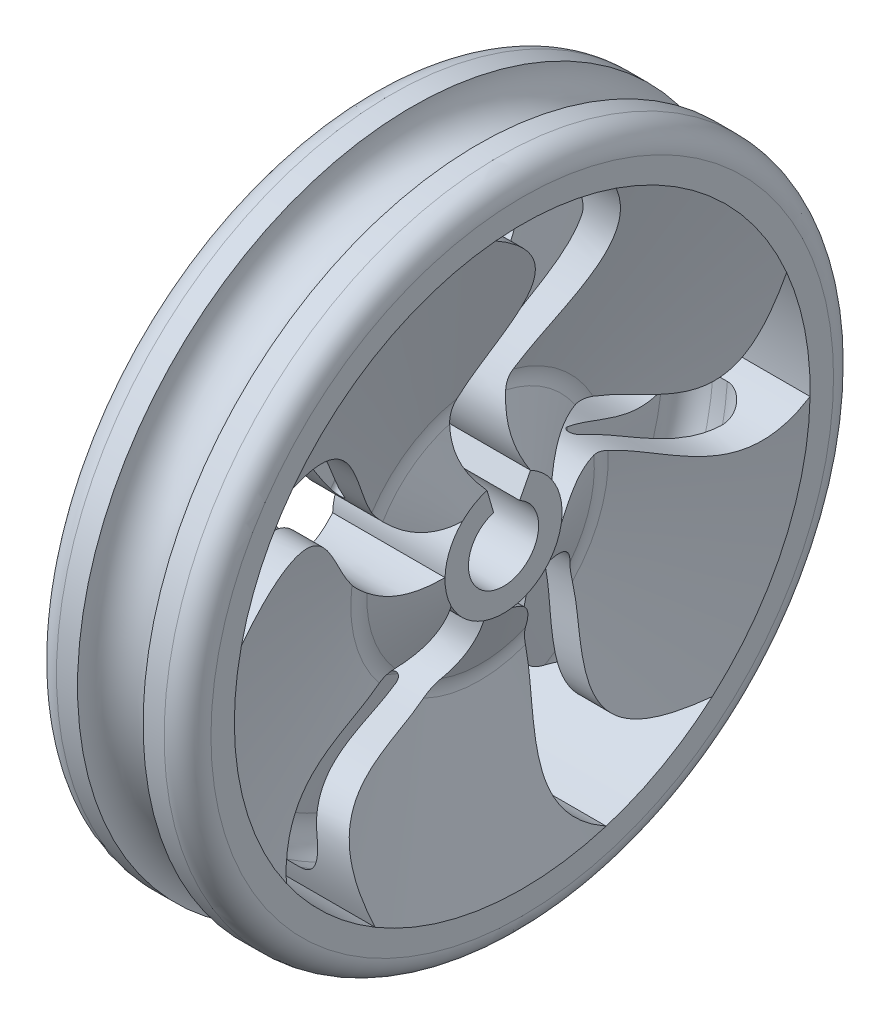
from build123d import *

# Parameters (mm, degrees)
CORTAR_EXTRUIR1_DEPTH = 10
MATRIZC3_COUNT        = 5
CORTAR_EXTRUIR2_DEPTH = 10


with BuildPart() as part:
    # Croquis1 → Revolución3 (revolve)
    with BuildSketch(Plane.XY, mode=Mode.PRIVATE) as revoluci_n3_sk:
        with BuildLine():
            Line((-1.4, 14.3), (-2.3, 14.3))
            ThreePointArc((-2.3, 14.3), (-3.007106781, 14.007106781), (-3.3, 13.3))
            Line((-3.3, 13.3), (-3.3, 12.3))
            Line((-3.3, 12.3), (-1.477590134, 5.507381409))
            ThreePointArc((-1.477590134, 5.507381409), (-1.443847989, 5.219445487), (-1.494116592, 4.933930697))
            Line((-1.494116592, 4.933930697), (-2.3, 2.5))
            Line((-2.3, 2.5), (-2.3, 0))
            Line((-2.3, 0), (0, 0))
            Line((0, 0), (2.5, 0))
            Line((2.5, 0), (2.5, 2.5))
            Line((2.5, 2.5), (1.518978689, 4.860727677))
            ThreePointArc((1.518978689, 4.860727677), (1.444586608, 5.17865535), (1.476575555, 5.503599797))
            Line((1.476575555, 5.503599797), (3.3, 12.3))
            Line((3.3, 12.3), (3.3, 13.3))
            ThreePointArc((3.3, 13.3), (3.007106781, 14.007106781), (2.3, 14.3))
            Line((2.3, 14.3), (1.4, 14.3))
            ThreePointArc((1.4, 14.3), (0, 12.9), (-1.4, 14.3))
        make_face()
        with BuildLine():
            Line((-0.200075313, 11.679856973), (0.410942501, 11.679856973))
            ThreePointArc((0.410942501, 11.679856973), (1.189122223, 11.307898628), (1.388401062, 10.468729614))
            Line((1.388401062, 10.468729614), (0.317355132, 5.510096987))
            ThreePointArc((0.317355132, 5.510096987), (0.019397239, 5.273472333), (-0.270967742, 5.519355051))
            Line((-0.270967742, 5.519355051), (-1.183693001, 10.499589827))
            ThreePointArc((-1.183693001, 10.499589827), (-0.968276832, 11.320065085), (-0.200075313, 11.679856973))
        make_face(mode=Mode.SUBTRACT)
    revolve(revoluci_n3_sk.sketch.rotate(Axis((0, 0, 0), (-1, 0, 0)), 90), axis=Axis((0, 0, 0), (-1, 0, 0)))

    # Croquis2 → Cortar-Extruir1 (cut, symmetric)
    with BuildSketch(Plane(origin=(2.5, 0, 0), x_dir=(0, 0, -1), z_dir=(1, 0, 0))):
        with BuildLine():
            ThreePointArc((1.152362183, 2.218571928), (0.241454488, 2.488312627), (-0.704319731, 2.398735858))
            add(Edge.make_bspline(
                [(-0.704319731, 2.398735858), (-4.011286327, 6.222872554), (5.571030349, 7.867972439), (-1.135052253, 12.247516335)],
                knots=[0, 0, 0, 0, 1, 1, 1, 1], degree=3))
            ThreePointArc((-1.135052253, 12.247516335), (1.473340993, 12.211439977), (4.015463433, 11.626093644))
            add(Edge.make_bspline(
                [(1.152362183, 2.218571928), (-0.97403928, 6.006226454), (6.397095126, 7.244213151), (4.015463433, 11.626093644)],
                knots=[0, 0, 0, 0, 1, 1, 1, 1], degree=3))
        make_face()
    cortar_extruir1 = extrude(amount=CORTAR_EXTRUIR1_DEPTH, both=True, mode=Mode.SUBTRACT)

    # MatrizC3: Cortar-Extruir1 ×5 about axis
    matrizc3_axis = Axis((2.5, 0, 0), (-1, 0, 0))
    for i in range(1, MATRIZC3_COUNT):
        add(cortar_extruir1.rotate(matrizc3_axis, i * 360 / MATRIZC3_COUNT), mode=Mode.SUBTRACT)

    # Croquis4 → Cortar-Extruir2 (cut)
    with BuildSketch(Plane(origin=(2.5, 0, 0), x_dir=(0, 0, -1), z_dir=(1, 0, 0))):
        with BuildLine():
            Line((-0.422591839, 1.439241515), (-0.704319731, 2.398735858))
            ThreePointArc((-0.704319731, 2.398735858), (0.241454488, 2.488312627), (1.152362183, 2.218571928))
            Line((1.152362183, 2.218571928), (0.69141731, 1.331143157))
            ThreePointArc((0.69141731, 1.331143157), (-0.144872693, -1.492987576), (-0.422591839, 1.439241515))
        make_face()
    extrude(amount=-CORTAR_EXTRUIR2_DEPTH, mode=Mode.SUBTRACT)


solid = part.part
